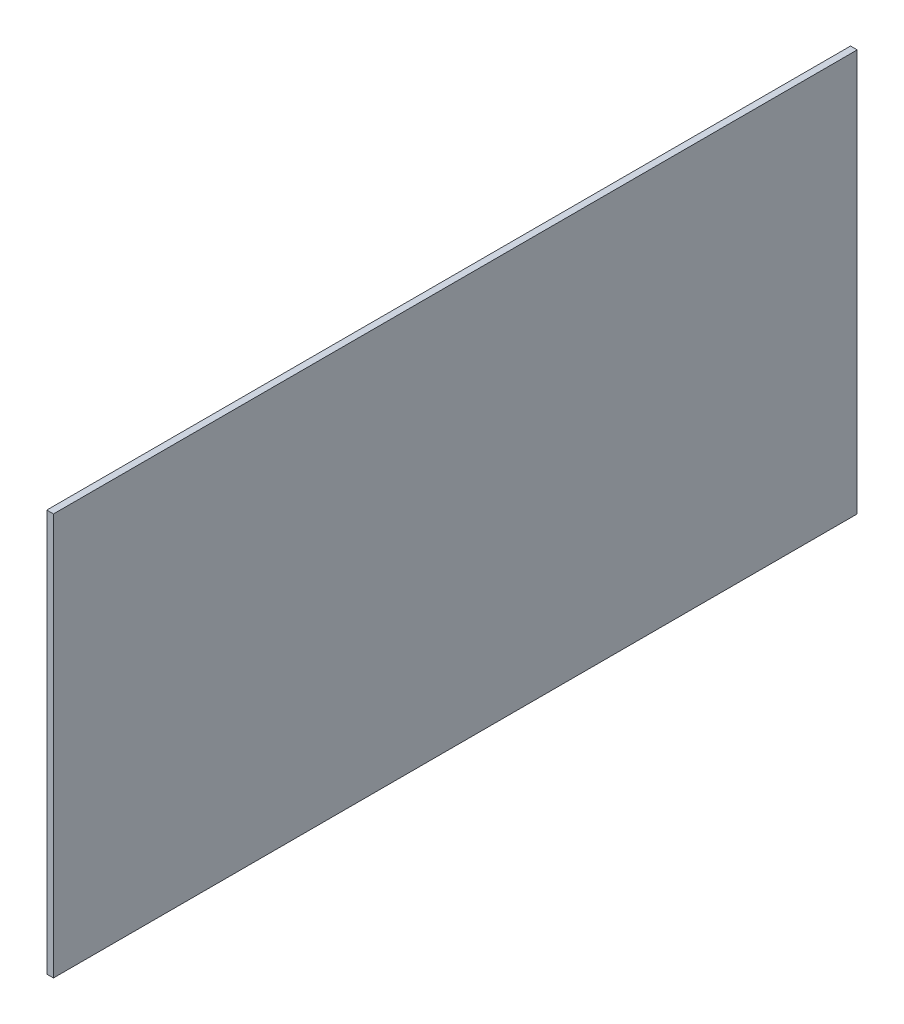
from build123d import *

# Parameters (mm, degrees)
CROQUIS1_W              = 600
CROQUIS1_H              = 300
SALIENTE_EXTRUIR1_DEPTH = 5


with BuildPart() as part:
    # Croquis1 → Saliente-Extruir1 (new body)
    with BuildSketch(Plane(origin=(0, 0, 0), x_dir=(0, 0, -1), z_dir=(1, 0, 0))):
        Rectangle(CROQUIS1_W, CROQUIS1_H)
    extrude(amount=SALIENTE_EXTRUIR1_DEPTH)


solid = part.part
